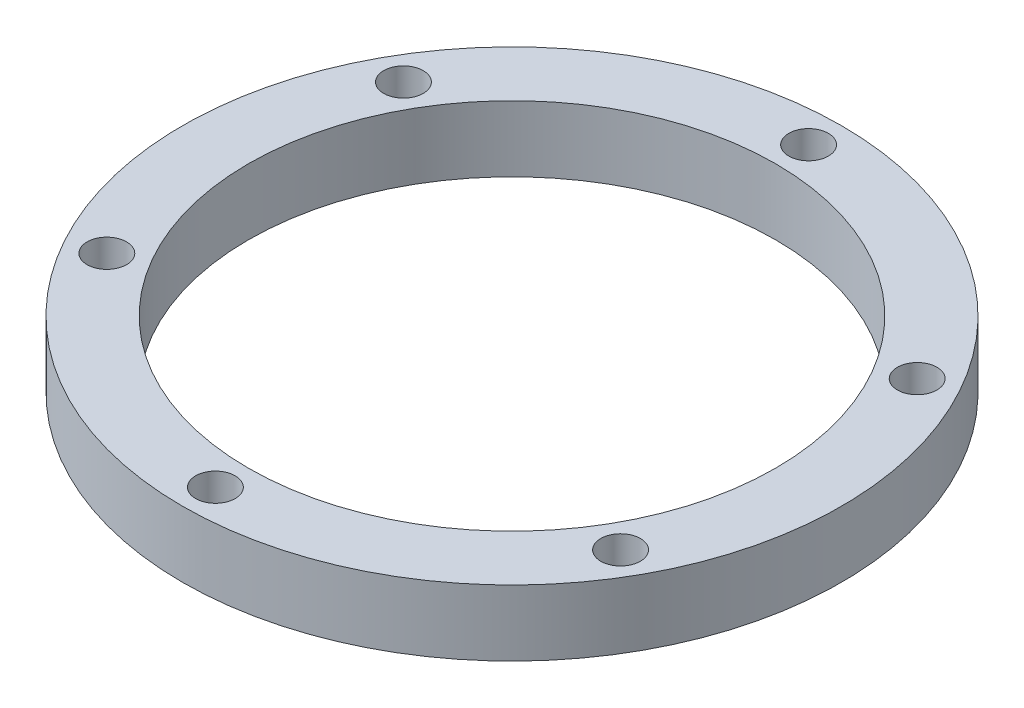
from build123d import *

# Parameters (mm, degrees)
SKETCH2_R           = 50
SKETCH2_R_2         = 40
BOSS_EXTRUDE1_DEPTH = 10
SKETCH3_R           = 3
CUT_EXTRUDE1_DEPTH  = 38


with BuildPart() as part:
    # Sketch2 → Boss-Extrude1 (new body)
    with BuildSketch(Plane(origin=(0, 0, 0), x_dir=(1, 0, 0), z_dir=(0, 1, 0))):
        with Locations(Location((0, 0, 0), (0, 0, 270))):
            Circle(SKETCH2_R)
        with Locations(Location((0, 0, 0), (0, 0, 270))):
            Circle(SKETCH2_R_2, mode=Mode.SUBTRACT)
    extrude(amount=BOSS_EXTRUDE1_DEPTH)

    # Sketch3 → Cut-Extrude1 (cut)
    with BuildSketch(Plane(origin=(0, 10, 0), x_dir=(1, 0, 0), z_dir=(0, 1, 0))):
        with Locations(Location((0, 45, 0), (0, 0, 270))):
            Circle(SKETCH3_R)
        with Locations(Location((38.97114317, 22.5, 0), (0, 0, 270))):
            Circle(SKETCH3_R)
        with Locations(Location((38.97114317, -22.5, 0), (0, 0, 270))):
            Circle(SKETCH3_R)
        with Locations(Location((0, -45, 0), (0, 0, 270))):
            Circle(SKETCH3_R)
        with Locations(Location((-38.97114317, -22.5, 0), (0, 0, 270))):
            Circle(SKETCH3_R)
        with Locations(Location((-38.97114317, 22.5, 0), (0, 0, 270))):
            Circle(SKETCH3_R)
    extrude(amount=-CUT_EXTRUDE1_DEPTH, mode=Mode.SUBTRACT)


solid = part.part
